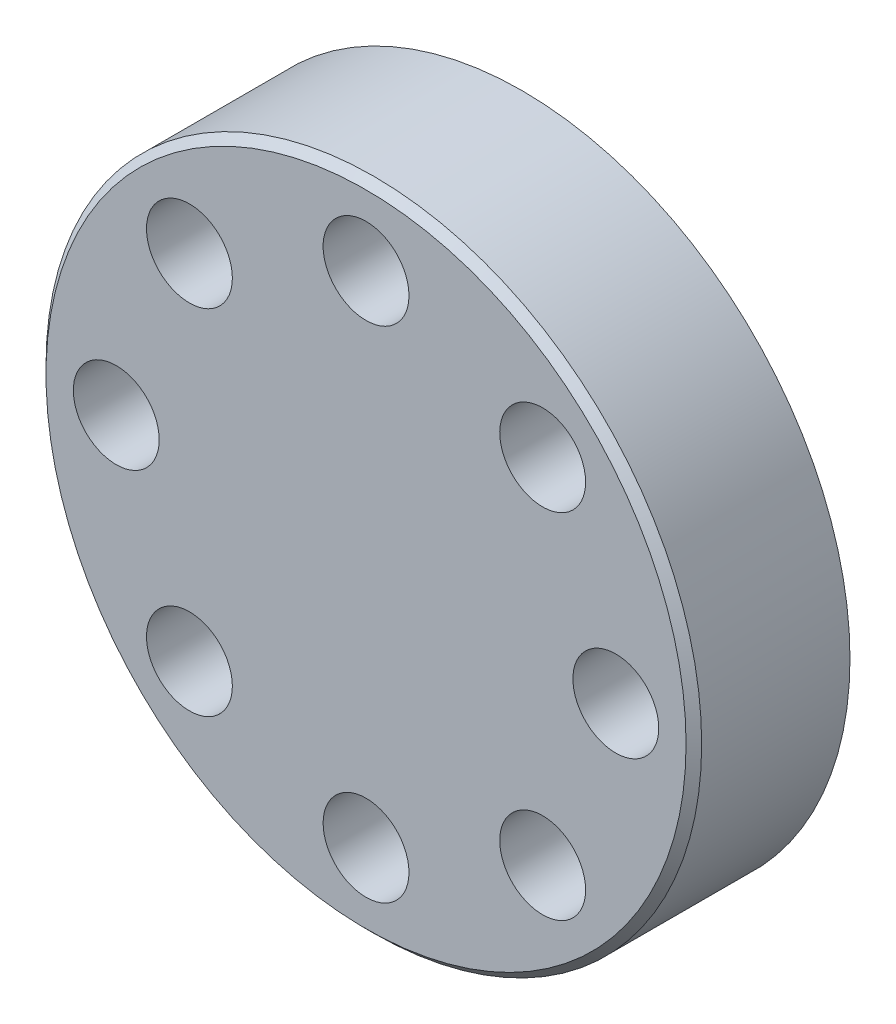
from build123d import *

# Parameters (mm, degrees)
SCHIZZO1_R                   = 7
ESTRUSIONE_ESTRUSIONE1_DEPTH = 8
SCHIZZO2_R                   = 21
ESTRUSIONE_ESTRUSIONE2_DEPTH = 10
SCHIZZO3_R                   = 2.75
TAGLIO_ESTRUSIONE1_DEPTH     = 35.727510708
RIPETIZIONECIRCOLARE1_COUNT  = 8
SMUSSO1_SIZE                 = 0.5
SMUSSO2_SIZE                 = 0.5


with BuildPart() as part:
    # Schizzo1 → Estrusione-Estrusione1 (new body)
    with BuildSketch(Plane.XY):
        Circle(SCHIZZO1_R)
    extrude(amount=ESTRUSIONE_ESTRUSIONE1_DEPTH)

    # Schizzo2 → Estrusione-Estrusione2 (add)
    with BuildSketch(Plane.XY.offset(8)):
        Circle(SCHIZZO2_R)
    extrude(amount=ESTRUSIONE_ESTRUSIONE2_DEPTH)

    # Schizzo3 → Taglio-Estrusione1 (cut, through all)
    with BuildSketch(Plane.XY.offset(18)):
        with Locations((0, 16)):
            Circle(SCHIZZO3_R)
    taglio_estrusione1 = extrude(amount=-TAGLIO_ESTRUSIONE1_DEPTH, mode=Mode.SUBTRACT)

    # RipetizioneCircolare1: Taglio-Estrusione1 ×8 about axis
    ripetizionecircolare1_axis = Axis((0, 0, 0), (0, 0, 1))
    for i in range(1, RIPETIZIONECIRCOLARE1_COUNT):
        add(taglio_estrusione1.rotate(ripetizionecircolare1_axis, i * 360 / RIPETIZIONECIRCOLARE1_COUNT), mode=Mode.SUBTRACT)

    # Smusso1
    smusso1_edges = [part.edges().sort_by_distance(p)[0] for p in [
        (-7, 0, 0),
    ]]
    chamfer(smusso1_edges, length=SMUSSO1_SIZE)

    # Smusso2
    smusso2_edges = [part.edges().sort_by_distance(p)[0] for p in [
        (-21, 0, 18),
    ]]
    chamfer(smusso2_edges, length=SMUSSO2_SIZE)


solid = part.part
